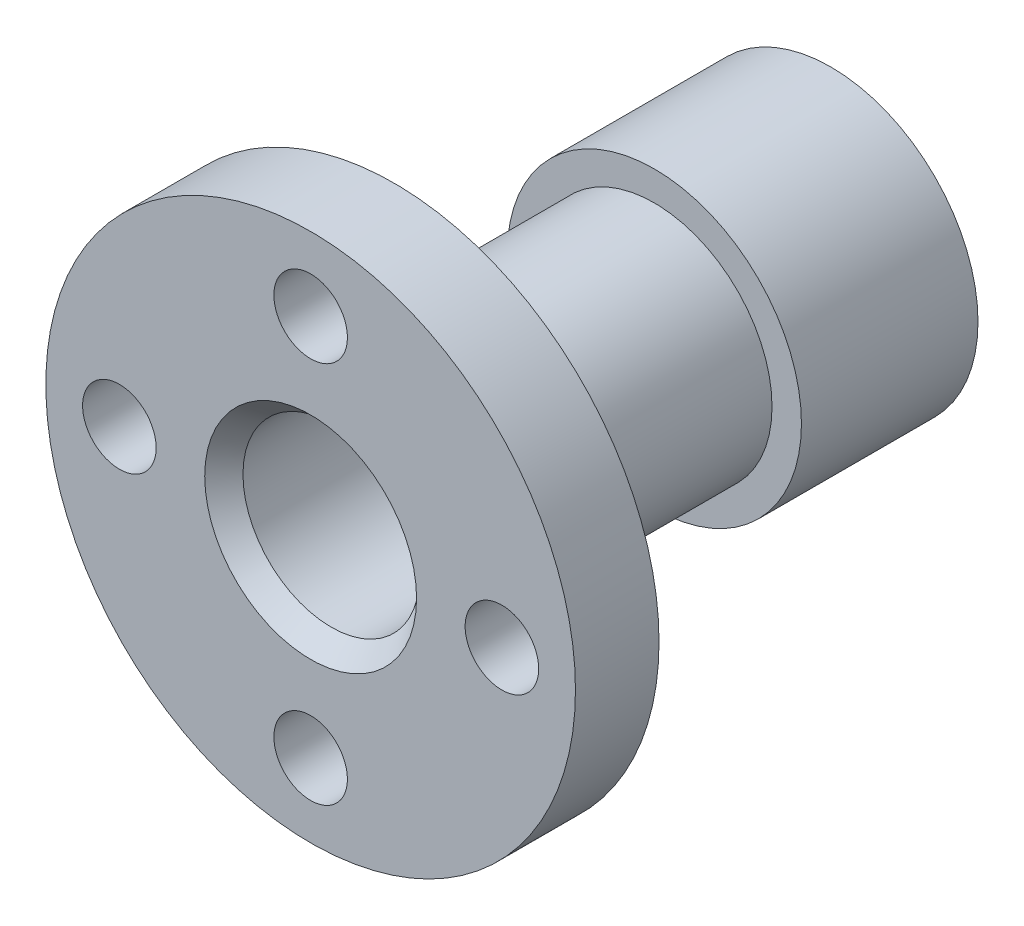
from build123d import *

# Parameters (mm, degrees)
CROQUIS1_R              = 45
SALIENTE_EXTRUIR2_DEPTH = 14.2
CROQUIS3_R              = 20
SALIENTE_EXTRUIR3_DEPTH = 44.2
CROQUIS7_R              = 15
CORTAR_EXTRUIR1_DEPTH   = 58.4
CROQUIS8_R              = 25
SALIENTE_EXTRUIR7_DEPTH = 30
CROQUIS9_R              = 19
CORTAR_EXTRUIR2_DEPTH   = 24
CROQUIS11_R             = 15
CORTAR_EXTRUIR3_DEPTH   = 6
CHAFL_N1_SIZE           = 3.5
CHAFL_N1_SIZE2          = 3
CROQUIS12_R             = 6.25
CORTAR_EXTRUIR4_DEPTH   = 14.2


with BuildPart() as part:
    # Croquis1 → Saliente-Extruir2 (new body)
    with BuildSketch(Plane.XY):
        Circle(CROQUIS1_R)
    extrude(amount=SALIENTE_EXTRUIR2_DEPTH)

    # Croquis3 → Saliente-Extruir3 (add)
    with BuildSketch(Plane.XY):
        Circle(CROQUIS3_R)
    extrude(amount=-SALIENTE_EXTRUIR3_DEPTH)

    # Croquis7 → Cortar-Extruir1 (cut)
    with BuildSketch(Plane(origin=(0, 0, -44.2), x_dir=(-1, 0, 0), z_dir=(0, 0, -1))):
        Circle(CROQUIS7_R)
    extrude(amount=-CORTAR_EXTRUIR1_DEPTH, mode=Mode.SUBTRACT)

    # Croquis8 → Saliente-Extruir7 (add)
    with BuildSketch(Plane(origin=(0, 0, -44.2), x_dir=(-1, 0, 0), z_dir=(0, 0, -1))):
        Circle(CROQUIS8_R)
    extrude(amount=SALIENTE_EXTRUIR7_DEPTH)

    # Croquis9 → Cortar-Extruir2 (cut)
    with BuildSketch(Plane(origin=(0, 0, -74.2), x_dir=(-1, 0, 0), z_dir=(0, 0, -1))):
        Circle(CROQUIS9_R)
    extrude(amount=-CORTAR_EXTRUIR2_DEPTH, mode=Mode.SUBTRACT)

    # Croquis11 → Cortar-Extruir3 (cut)
    with BuildSketch(Plane(origin=(0, 0, -50.2), x_dir=(-1, 0, 0), z_dir=(0, 0, -1))):
        Circle(CROQUIS11_R)
    extrude(amount=-CORTAR_EXTRUIR3_DEPTH, mode=Mode.SUBTRACT)

    # Chaflán1
    chafl_n1_edges = [part.edges().sort_by_distance(p)[0] for p in [
        (15, 0, 14.2),
    ]]
    chafl_n1_side = [part.faces().sort_by_distance(p)[0] for p in [
        (15, 0, -18),
    ]]
    chamfer(chafl_n1_edges, length=CHAFL_N1_SIZE, length2=CHAFL_N1_SIZE2, reference=chafl_n1_side[0])

    # Croquis12 → Cortar-Extruir4 (cut)
    with BuildSketch(Plane.XY.offset(14.2)):
        with Locations((0, 32.5)):
            Circle(CROQUIS12_R)
        with Locations((32.5, 0)):
            Circle(CROQUIS12_R)
        with Locations((0, -32.5)):
            Circle(CROQUIS12_R)
        with Locations((-32.5, 0)):
            Circle(CROQUIS12_R)
    extrude(amount=-CORTAR_EXTRUIR4_DEPTH, mode=Mode.SUBTRACT)


solid = part.part
